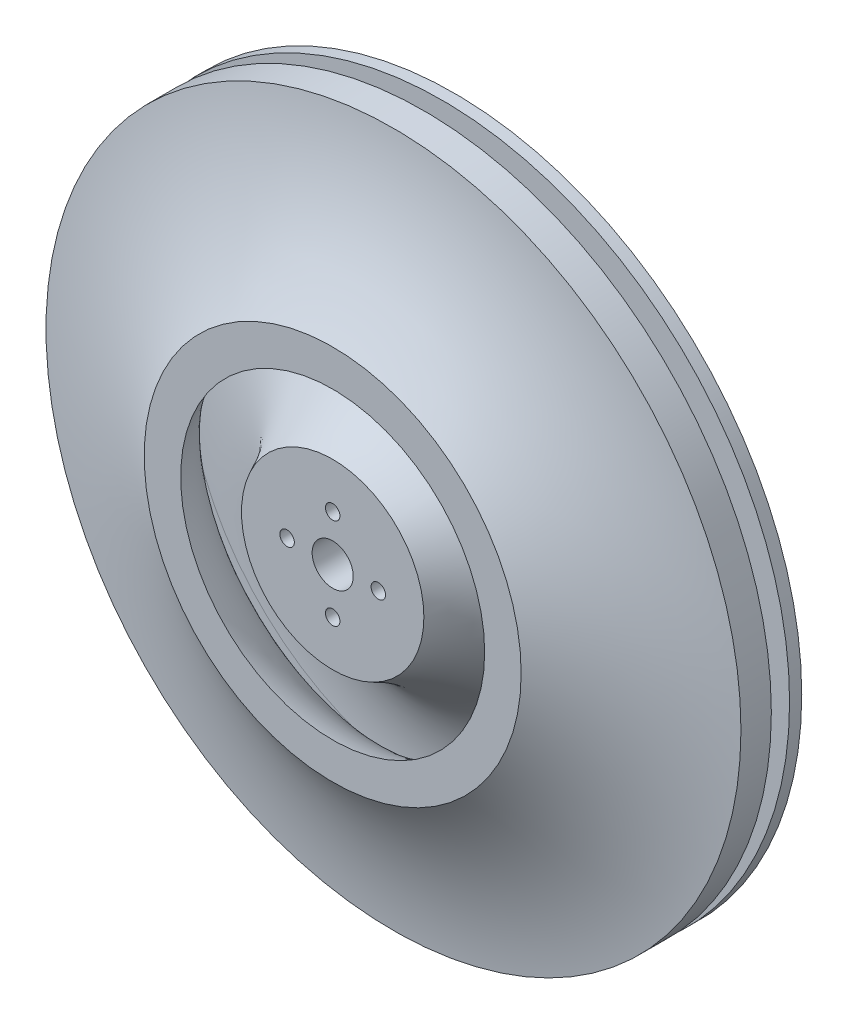
from build123d import *

# Parameters (mm, degrees)
CUT_EXTRUDE1_DEPTH      = 84.260104492
CUT_EXTRUDE1_DEPTH_BACK = 84.260104492
SKETCH2_R               = 1.190625
SKETCH2_R_2             = 3.3782


with BuildPart() as part:
    # Sketch1 → Revolve1 (revolve)
    with BuildSketch(Plane.YZ, mode=Mode.PRIVATE) as revolve1_sk:
        with BuildLine():
            Line((-57.15, 10), (-57.15, 5))
            Line((-57.15, 5), (-42.15, 6.312329953))
            ThreePointArc((-42.15, 6.312329953), (-31.509122685, 10.567718891), (-25, 20))
            Line((-25, 20), (-31, 20))
            ThreePointArc((-31, 20), (-43.428055952, 13.308241315), (-57.15, 10))
        make_face()
        with BuildLine():
            ThreePointArc((-42.15, 2), (-25.862562356, 6.908739887), (-15, 20))
            Line((-15, 20), (0, 20))
            Line((0, 20), (0, 5))
            Line((0, 5), (-15, 5))
            Line((-15, 5), (-15, 0))
            Line((-15, 0), (-25.275, 0))
            Line((-25.275, 0), (-25.275, 1))
            Line((-25.275, 1), (-27.525, 1))
            Line((-27.525, 1), (-27.525, 0))
            Line((-27.525, 0), (-29.275, 0))
            Line((-29.275, 0), (-29.275, 1))
            Line((-29.275, 1), (-31.525, 1))
            Line((-31.525, 1), (-31.525, 0))
            Line((-31.525, 0), (-33.275, 0))
            Line((-33.275, 0), (-33.275, 1))
            Line((-33.275, 1), (-35.525, 1))
            Line((-35.525, 1), (-35.525, 0))
            Line((-35.525, 0), (-37.275, 0))
            Line((-37.275, 0), (-37.275, 1))
            Line((-37.275, 1), (-39.525, 1))
            Line((-39.525, 1), (-39.525, 0))
            Line((-39.525, 0), (-57.15, 0))
            Line((-57.15, 0), (-57.15, 2))
            Line((-57.15, 2), (-42.15, 2))
        make_face()
    revolve(revolve1_sk.sketch.rotate(Axis((0, 0, 21), (0, 0, -1)), 270), axis=Axis((0, 0, 21), (0, 0, -1)))

    # Sketch2 → Cut-Extrude1 (cut, two sides: drawn at the far end of the back side and taken through both)
    with BuildSketch(Plane(origin=(0, 0, 0), x_dir=(0, 1, 0), z_dir=(0, 0, 1)).offset(-CUT_EXTRUDE1_DEPTH_BACK)):
        with Locations(Location((-7.5, 0, 0), (0, 0, 270))):
            Circle(SKETCH2_R)
        with Locations(Location((0, 7.5, 0), (0, 0, 270))):
            Circle(SKETCH2_R)
        with Locations(Location((7.5, 0, 0), (0, 0, 270))):
            Circle(SKETCH2_R)
        with Locations(Location((0, -7.5, 0), (0, 0, 270))):
            Circle(SKETCH2_R)
        with Locations(Location((0, 0, 0), (0, 0, 270))):
            Circle(SKETCH2_R_2)
    extrude(amount=CUT_EXTRUDE1_DEPTH + CUT_EXTRUDE1_DEPTH_BACK, mode=Mode.SUBTRACT)


solid = part.part
